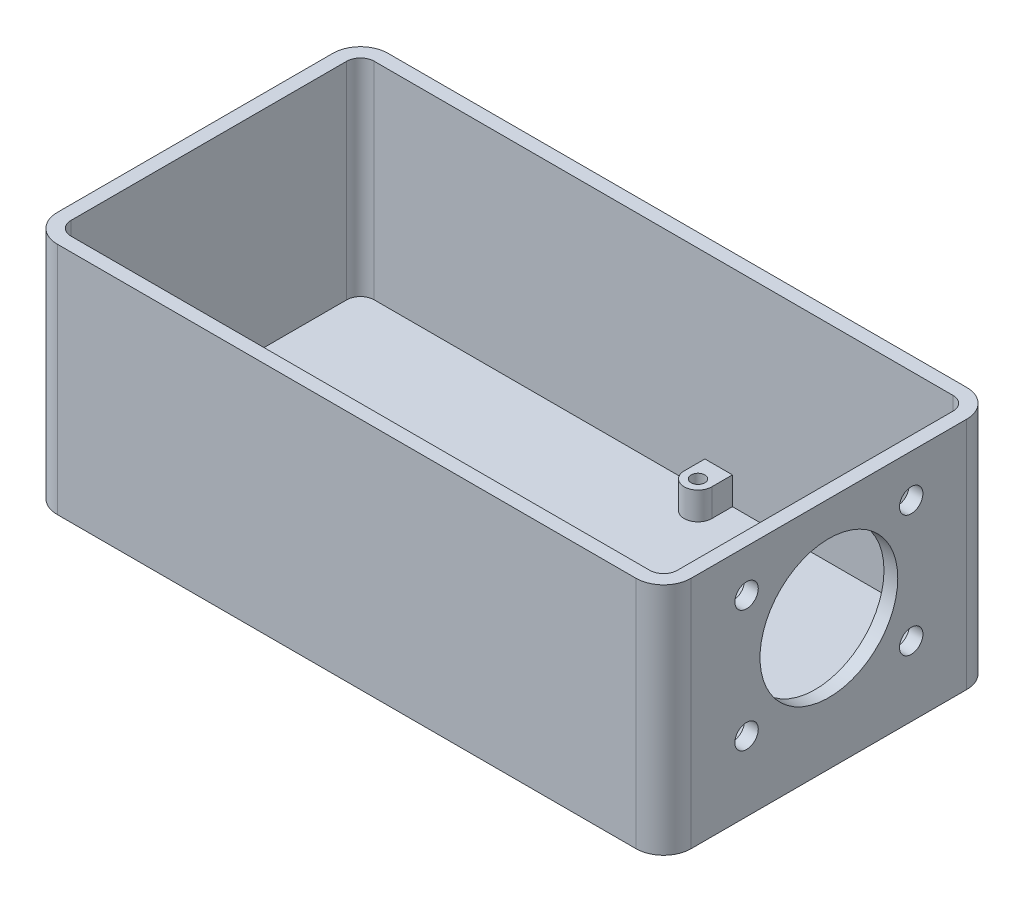
from build123d import *

# Parameters (mm, degrees)
SKETCH1_W            = 116.84
SKETCH1_H            = 86.36
BOSS_EXTRUDE2_DEPTH  = 5.08
FILLET1_R            = 12.7
SKETCH3_W            = 116.84
SKETCH3_H            = 60.96
SKETCH3_W_2          = 111.76
SKETCH3_H_2          = 55.88
BOSS_EXTRUDE3_DEPTH  = 38.1
SKETCH4_W            = 10.16
SKETCH4_H            = 10.16
BOSS_EXTRUDE5_DEPTH  = 34.29
FILLET3_R            = 5.08
SKETCH5_R            = 1.27
CUT_EXTRUDE1_DEPTH   = 34.29
CUT_EXTRUDE2_START   = -5.08
SKETCH6_W            = 198.457473549
SKETCH6_H            = 149.814535244
SKETCH6_W_2          = 116.84
SKETCH6_H_2          = 60.96
CUT_EXTRUDE2_DEPTH   = 5.08
FILLET6_R            = 5.08
CUT_EXTRUDE3_REACH   = 146.713
SKETCH7_R            = 12.7
SKETCH7_R_2          = 2.159
CUT_EXTRUDE4_REACH   = 146.713
SKETCH8_R            = 3.175
BOSS_EXTRUDE9_DEPTH  = 5.08
SKETCH14_R           = 1.27
CUT_EXTRUDE6_DEPTH   = 8.89
SKETCH21_W           = 111.76
SKETCH21_H           = 55.88
CUT_EXTRUDE7_DEPTH   = 29.21
SKETCH22_W           = 20.924478465
SKETCH22_H           = 12.476012494
SKETCH22_W_2         = 15.618152649
SKETCH22_H_2         = 14.190033702
SKETCH22_W_3         = 16.110334819
SKETCH22_H_3         = 13.876033943
SKETCH22_W_4         = 12.045494613
CUT_EXTRUDE8_DEPTH   = 5.08
FILLET7_R            = 2.54
BOSS_EXTRUDE10_DEPTH = 5.08


with BuildPart() as part:
    # Sketch1 → Boss-Extrude2 (new body)
    with BuildSketch(Plane(origin=(0, 0, 0), x_dir=(1, 0, 0), z_dir=(0, 1, 0))):
        with Locations((58.42, 43.18)):
            Rectangle(SKETCH1_W, SKETCH1_H)
    extrude(amount=BOSS_EXTRUDE2_DEPTH)

    # Fillet1
    fillet1_edges = [part.edges().sort_by_distance(p)[0] for p in [
        (0, 2.54, -86.36),
        (116.84, 2.54, -86.36),
        (116.84, 2.54, 0),
        (0, 2.54, 0),
    ]]
    fillet(fillet1_edges, radius=FILLET1_R)

    # Sketch3 → Boss-Extrude3 (add)
    with BuildSketch(Plane(origin=(0, 5.08, 0), x_dir=(1, 0, 0), z_dir=(0, 1, 0))):
        with Locations((58.42, 43.18)):
            Rectangle(SKETCH3_W, SKETCH3_H)
        with Locations((58.42, 43.18)):
            Rectangle(SKETCH3_W_2, SKETCH3_H_2, mode=Mode.SUBTRACT)
    extrude(amount=BOSS_EXTRUDE3_DEPTH)

    # Sketch4 → Boss-Extrude5 (add)
    with BuildSketch(Plane(origin=(0, 5.08, 0), x_dir=(1, 0, 0), z_dir=(0, 1, 0))):
        with Locations((7.62, 66.04)):
            Rectangle(SKETCH4_W, SKETCH4_H)
        with Locations((109.22, 66.04)):
            Rectangle(SKETCH4_W, SKETCH4_H)
        with Locations((109.22, 20.32)):
            Rectangle(SKETCH4_W, SKETCH4_H)
        with Locations((7.62, 20.32)):
            Rectangle(SKETCH4_W, SKETCH4_H)
    extrude(amount=BOSS_EXTRUDE5_DEPTH)

    # Fillet3
    fillet3_edges = [part.edges().sort_by_distance(p)[0] for p in [
        (12.7, 22.225, -25.4),
        (12.7, 22.225, -60.96),
        (104.14, 22.225, -60.96),
        (104.14, 22.225, -25.4),
    ]]
    fillet(fillet3_edges, radius=FILLET3_R)

    # Sketch5 → Cut-Extrude1 (cut)
    with BuildSketch(Plane(origin=(0, 39.37, 0), x_dir=(1, 0, 0), z_dir=(0, 1, 0))):
        with Locations(Location((7.62, 66.04, 0), (0, 0, 270))):
            Circle(SKETCH5_R)
        with Locations(Location((109.22, 66.04, 0), (0, 0, 270))):
            Circle(SKETCH5_R)
        with Locations(Location((109.22, 20.32, 0), (0, 0, 270))):
            Circle(SKETCH5_R)
        with Locations(Location((7.62, 20.32, 0), (0, 0, 270))):
            Circle(SKETCH5_R)
    extrude(amount=-CUT_EXTRUDE1_DEPTH, mode=Mode.SUBTRACT)

    # Sketch6 → Cut-Extrude2 (cut)
    with BuildSketch(Plane(origin=(0, 5.08, 0), x_dir=(1, 0, 0), z_dir=(0, 1, 0)).offset(CUT_EXTRUDE2_START)):
        with Locations((67.603582621, 44.619641428)):
            Rectangle(SKETCH6_W, SKETCH6_H)
        with Locations((58.42, 43.18)):
            Rectangle(SKETCH6_W_2, SKETCH6_H_2, mode=Mode.SUBTRACT)
    extrude(amount=CUT_EXTRUDE2_DEPTH, mode=Mode.SUBTRACT)

    # Fillet6
    fillet6_edges = [part.edges().sort_by_distance(p)[0] for p in [
        (0, 21.59, -12.7),
        (0, 21.59, -73.66),
        (116.84, 21.59, -12.7),
        (116.84, 21.59, -73.66),
    ]]
    fillet(fillet6_edges, radius=FILLET6_R)

    # Sketch7 → Cut-Extrude3 (cut, up to next)
    with BuildSketch(Plane(origin=(116.84, 0, 0), x_dir=(0, 0, -1), z_dir=(1, 0, 0)), mode=Mode.PRIVATE) as cut_extrude3_sk1:
        with Locations((43.18, 24.13)):
            Circle(SKETCH7_R)
    cut_extrude3_tool1 = extrude(cut_extrude3_sk1.sketch, amount=-CUT_EXTRUDE3_REACH, mode=Mode.PRIVATE) & part.part
    # Sketch7 → Cut-Extrude3 (cut, up to next)
    with BuildSketch(Plane(origin=(116.84, 0, 0), x_dir=(0, 0, -1), z_dir=(1, 0, 0)), mode=Mode.PRIVATE) as cut_extrude3_sk2:
        with Locations((28.0035, 35.3568)):
            Circle(SKETCH7_R_2)
    cut_extrude3_tool2 = extrude(cut_extrude3_sk2.sketch, amount=-CUT_EXTRUDE3_REACH, mode=Mode.PRIVATE) & part.part
    # Sketch7 → Cut-Extrude3 (cut, up to next)
    with BuildSketch(Plane(origin=(116.84, 0, 0), x_dir=(0, 0, -1), z_dir=(1, 0, 0)), mode=Mode.PRIVATE) as cut_extrude3_sk3:
        with Locations((58.3565, 35.3568)):
            Circle(SKETCH7_R_2)
    cut_extrude3_tool3 = extrude(cut_extrude3_sk3.sketch, amount=-CUT_EXTRUDE3_REACH, mode=Mode.PRIVATE) & part.part
    # Sketch7 → Cut-Extrude3 (cut, up to next)
    with BuildSketch(Plane(origin=(116.84, 0, 0), x_dir=(0, 0, -1), z_dir=(1, 0, 0)), mode=Mode.PRIVATE) as cut_extrude3_sk4:
        with Locations((28.0035, 12.9032)):
            Circle(SKETCH7_R_2)
    cut_extrude3_tool4 = extrude(cut_extrude3_sk4.sketch, amount=-CUT_EXTRUDE3_REACH, mode=Mode.PRIVATE) & part.part
    # Sketch7 → Cut-Extrude3 (cut, up to next)
    with BuildSketch(Plane(origin=(116.84, 0, 0), x_dir=(0, 0, -1), z_dir=(1, 0, 0)), mode=Mode.PRIVATE) as cut_extrude3_sk5:
        with Locations((58.3565, 12.9032)):
            Circle(SKETCH7_R_2)
    cut_extrude3_tool5 = extrude(cut_extrude3_sk5.sketch, amount=-CUT_EXTRUDE3_REACH, mode=Mode.PRIVATE) & part.part
    add(cut_extrude3_tool1.solids().sort_by_distance((116.84, 24.13, -43.18))[0], mode=Mode.SUBTRACT)
    add(cut_extrude3_tool2.solids().sort_by_distance((116.84, 35.3568, -28.0035))[0], mode=Mode.SUBTRACT)
    add(cut_extrude3_tool3.solids().sort_by_distance((116.84, 35.3568, -58.3565))[0], mode=Mode.SUBTRACT)
    add(cut_extrude3_tool4.solids().sort_by_distance((116.84, 12.9032, -28.0035))[0], mode=Mode.SUBTRACT)
    add(cut_extrude3_tool5.solids().sort_by_distance((116.84, 12.9032, -58.3565))[0], mode=Mode.SUBTRACT)

    # Sketch8 → Cut-Extrude4 (cut, up to next)
    with BuildSketch(Plane.ZY, mode=Mode.PRIVATE) as cut_extrude4_sk1:
        with Locations((-43.18, 10.16)):
            Circle(SKETCH8_R)
    cut_extrude4_tool1 = extrude(cut_extrude4_sk1.sketch, amount=-CUT_EXTRUDE4_REACH, mode=Mode.PRIVATE) & part.part
    add(cut_extrude4_tool1.solids().sort_by_distance((0, 10.16, -43.18))[0], mode=Mode.SUBTRACT)

    # Sketch10 → Boss-Extrude9 (add)
    with BuildSketch(Plane(origin=(0, 5.08, 0), x_dir=(1, 0, 0), z_dir=(0, 1, 0))):
        with BuildLine():
            Line((69.85, 19.05), (69.85, 15.24))
            Line((69.85, 15.24), (64.77, 15.24))
            Line((64.77, 15.24), (64.77, 19.05))
            ThreePointArc((64.77, 19.05), (67.31, 21.59), (69.85, 19.05))
        make_face()
        with BuildLine():
            Line((71.12, 67.31), (71.12, 71.12))
            Line((71.12, 71.12), (66.04, 71.12))
            Line((66.04, 71.12), (66.04, 67.31))
            ThreePointArc((66.04, 67.31), (68.58, 64.77), (71.12, 67.31))
        make_face()
    extrude(amount=BOSS_EXTRUDE9_DEPTH)

    # Sketch14 → Cut-Extrude6 (cut)
    with BuildSketch(Plane(origin=(0, 10.16, 0), x_dir=(1, 0, 0), z_dir=(0, 1, 0))):
        with Locations(Location((67.31, 19.05, 0), (0, 0, 270))):
            Circle(SKETCH14_R)
        with Locations(Location((68.58, 67.31, 0), (0, 0, 270))):
            Circle(SKETCH14_R)
    extrude(amount=-CUT_EXTRUDE6_DEPTH, mode=Mode.SUBTRACT)

    # Sketch21 → Cut-Extrude7 (cut)
    with BuildSketch(Plane(origin=(0, 39.37, 0), x_dir=(1, 0, 0), z_dir=(0, 1, 0))):
        with Locations((58.42, 43.18)):
            Rectangle(SKETCH21_W, SKETCH21_H)
    extrude(amount=-CUT_EXTRUDE7_DEPTH, mode=Mode.SUBTRACT)

    # Sketch22 → Cut-Extrude8 (cut)
    with BuildSketch(Plane(origin=(0, 10.16, 0), x_dir=(1, 0, 0), z_dir=(0, 1, 0))):
        with Locations((103.837760768, 21.478006247)):
            Rectangle(SKETCH22_W, SKETCH22_H)
        with Locations((106.490923675, 64.024983149)):
            Rectangle(SKETCH22_W_2, SKETCH22_H_2)
        with Locations((10.59516741, 22.178016971)):
            Rectangle(SKETCH22_W_3, SKETCH22_H_3)
        with Locations((8.562747307, 64.024983149)):
            Rectangle(SKETCH22_W_4, SKETCH22_H_2)
    extrude(amount=-CUT_EXTRUDE8_DEPTH, mode=Mode.SUBTRACT)

    # Fillet7
    fillet7_edges = [part.edges().sort_by_distance(p)[0] for p in [
        (2.54, 24.13, -15.24),
        (114.3, 24.13, -15.24),
        (114.3, 24.13, -71.12),
        (2.54, 24.13, -71.12),
    ]]
    fillet(fillet7_edges, radius=FILLET7_R)

    # Sketch15 → Boss-Extrude10 (add)
    with BuildSketch(Plane(origin=(0, 5.08, 0), x_dir=(1, 0, 0), z_dir=(0, 1, 0))):
        with BuildLine():
            Line((21.59, 33.02), (21.59, 35.56))
            ThreePointArc((21.59, 35.56), (26.67, 40.64), (31.75, 35.56))
            Line((31.75, 35.56), (31.75, 33.02))
            ThreePointArc((31.75, 33.02), (26.67, 27.94), (21.59, 33.02))
        make_face()
    extrude(amount=BOSS_EXTRUDE10_DEPTH)


solid = part.part
